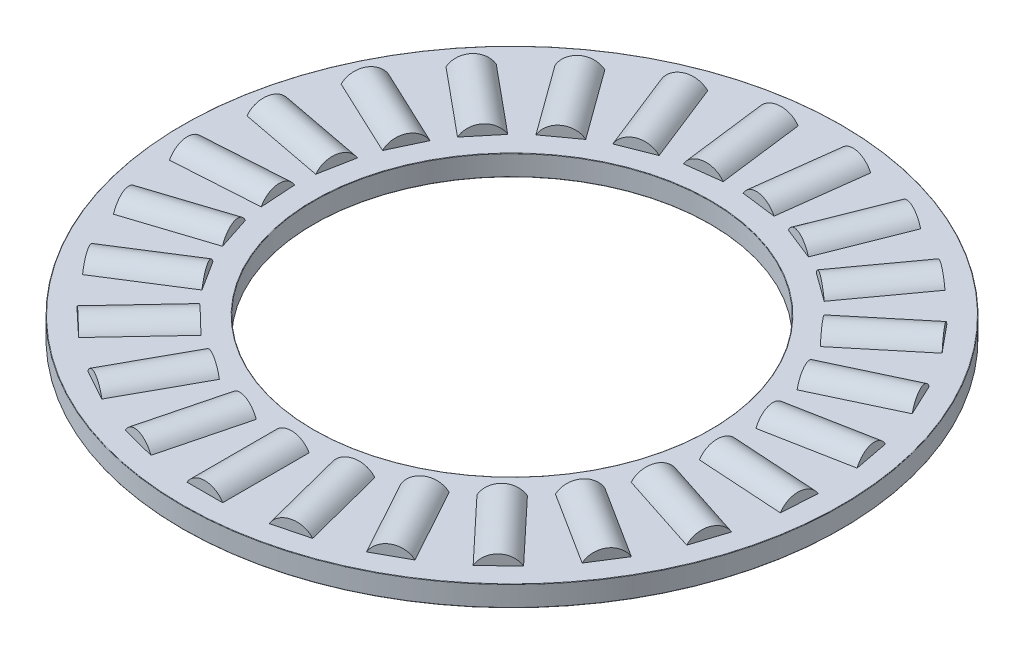
from build123d import *

# Parameters (mm, degrees)
SKETCH1_W         = 6.3246
SKETCH1_H         = 0.9921875
SKETCH3_W         = 4.1671875
SKETCH3_H         = 0.9921875
SKETCH2_W         = 4.1671875
SKETCH2_H         = 0.9921875
CIRPATTERN1_COUNT = 25
CIRPATTERN1_ANGLE = 345.6
CIRPATTERN2_COUNT = 25
FILLET2_R         = 0.01984375


with BuildPart() as part:
    # Sketch1 → Revolve1 (revolve)
    with BuildSketch(Plane(origin=(0, 0, 0), x_dir=(0, 0, -1), z_dir=(1, 0, 0)), mode=Mode.PRIVATE) as revolve1_sk:
        with Locations((-12.7127, 0)):
            Rectangle(SKETCH1_W, SKETCH1_H)
    revolve(revolve1_sk.sketch.rotate(Axis((0, -0.9921875, 0), (0, 1, 0)), 180), axis=Axis((0, -0.9921875, 0), (0, 1, 0)))

    # Sketch3 → Cut-Revolve1 (revolve, cut)
    with BuildSketch(Plane(origin=(0, 0, 0), x_dir=(0, 0, -1), z_dir=(1, 0, 0))):
        with Locations((-12.7127, 0.49609375)):
            Rectangle(SKETCH3_W, SKETCH3_H)
    cut_revolve1 = revolve(axis=Axis((0, 0, 14.79629375), (0, 0, -1)), mode=Mode.SUBTRACT)

    # CirPattern2: Cut-Revolve1 ×25 about axis
    cirpattern2_axis = Axis((0, 0, 0), (0, 1, 0))
    for i in range(1, CIRPATTERN2_COUNT):
        add(cut_revolve1.rotate(cirpattern2_axis, i * 360 / CIRPATTERN2_COUNT), mode=Mode.SUBTRACT)

    # Fillet2
    fillet2_edges = [part.edges().sort_by_distance(p)[0] for p in [
        (0, 0.49609375, 15.875),
        (0, 0.49609375, 9.5504),
        (0, -0.49609375, 9.5504),
        (0, -0.49609375, 15.875),
    ]]
    fillet(fillet2_edges, radius=FILLET2_R)


with BuildPart() as body_2:
    # Sketch2 → Revolve2 (revolve)
    with BuildSketch(Plane(origin=(0, 0, 0), x_dir=(0, 0, -1), z_dir=(1, 0, 0)), mode=Mode.PRIVATE) as revolve2_sk:
        with Locations((-12.7127, 0.49609375)):
            Rectangle(SKETCH2_W, SKETCH2_H)
    revolve(revolve2_sk.sketch.rotate(Axis((0, 0, 14.79629375), (0, 0, -1)), 90), axis=Axis((0, 0, 14.79629375), (0, 0, -1)))


with BuildPart() as cirpattern1_1:
    # CirPattern1: pattern copy
    add(body_2.part.rotate(Axis((0, 0.9921875, 0), (0, -1, 0)), 1 * CIRPATTERN1_ANGLE / (CIRPATTERN1_COUNT - 1)))


with BuildPart() as cirpattern1_2:
    # CirPattern1: pattern copy
    add(body_2.part.rotate(Axis((0, 0.9921875, 0), (0, -1, 0)), 2 * CIRPATTERN1_ANGLE / (CIRPATTERN1_COUNT - 1)))


with BuildPart() as cirpattern1_3:
    # CirPattern1: pattern copy
    add(body_2.part.rotate(Axis((0, 0.9921875, 0), (0, -1, 0)), 3 * CIRPATTERN1_ANGLE / (CIRPATTERN1_COUNT - 1)))


with BuildPart() as cirpattern1_4:
    # CirPattern1: pattern copy
    add(body_2.part.rotate(Axis((0, 0.9921875, 0), (0, -1, 0)), 4 * CIRPATTERN1_ANGLE / (CIRPATTERN1_COUNT - 1)))


with BuildPart() as cirpattern1_5:
    # CirPattern1: pattern copy
    add(body_2.part.rotate(Axis((0, 0.9921875, 0), (0, -1, 0)), 5 * CIRPATTERN1_ANGLE / (CIRPATTERN1_COUNT - 1)))


with BuildPart() as cirpattern1_6:
    # CirPattern1: pattern copy
    add(body_2.part.rotate(Axis((0, 0.9921875, 0), (0, -1, 0)), 6 * CIRPATTERN1_ANGLE / (CIRPATTERN1_COUNT - 1)))


with BuildPart() as cirpattern1_7:
    # CirPattern1: pattern copy
    add(body_2.part.rotate(Axis((0, 0.9921875, 0), (0, -1, 0)), 7 * CIRPATTERN1_ANGLE / (CIRPATTERN1_COUNT - 1)))


with BuildPart() as cirpattern1_8:
    # CirPattern1: pattern copy
    add(body_2.part.rotate(Axis((0, 0.9921875, 0), (0, -1, 0)), 8 * CIRPATTERN1_ANGLE / (CIRPATTERN1_COUNT - 1)))


with BuildPart() as cirpattern1_9:
    # CirPattern1: pattern copy
    add(body_2.part.rotate(Axis((0, 0.9921875, 0), (0, -1, 0)), 9 * CIRPATTERN1_ANGLE / (CIRPATTERN1_COUNT - 1)))


with BuildPart() as cirpattern1_10:
    # CirPattern1: pattern copy
    add(body_2.part.rotate(Axis((0, 0.9921875, 0), (0, -1, 0)), 10 * CIRPATTERN1_ANGLE / (CIRPATTERN1_COUNT - 1)))


with BuildPart() as cirpattern1_11:
    # CirPattern1: pattern copy
    add(body_2.part.rotate(Axis((0, 0.9921875, 0), (0, -1, 0)), 11 * CIRPATTERN1_ANGLE / (CIRPATTERN1_COUNT - 1)))


with BuildPart() as cirpattern1_12:
    # CirPattern1: pattern copy
    add(body_2.part.rotate(Axis((0, 0.9921875, 0), (0, -1, 0)), 12 * CIRPATTERN1_ANGLE / (CIRPATTERN1_COUNT - 1)))


with BuildPart() as cirpattern1_13:
    # CirPattern1: pattern copy
    add(body_2.part.rotate(Axis((0, 0.9921875, 0), (0, -1, 0)), 13 * CIRPATTERN1_ANGLE / (CIRPATTERN1_COUNT - 1)))


with BuildPart() as cirpattern1_14:
    # CirPattern1: pattern copy
    add(body_2.part.rotate(Axis((0, 0.9921875, 0), (0, -1, 0)), 14 * CIRPATTERN1_ANGLE / (CIRPATTERN1_COUNT - 1)))


with BuildPart() as cirpattern1_15:
    # CirPattern1: pattern copy
    add(body_2.part.rotate(Axis((0, 0.9921875, 0), (0, -1, 0)), 15 * CIRPATTERN1_ANGLE / (CIRPATTERN1_COUNT - 1)))


with BuildPart() as cirpattern1_16:
    # CirPattern1: pattern copy
    add(body_2.part.rotate(Axis((0, 0.9921875, 0), (0, -1, 0)), 16 * CIRPATTERN1_ANGLE / (CIRPATTERN1_COUNT - 1)))


with BuildPart() as cirpattern1_17:
    # CirPattern1: pattern copy
    add(body_2.part.rotate(Axis((0, 0.9921875, 0), (0, -1, 0)), 17 * CIRPATTERN1_ANGLE / (CIRPATTERN1_COUNT - 1)))


with BuildPart() as cirpattern1_18:
    # CirPattern1: pattern copy
    add(body_2.part.rotate(Axis((0, 0.9921875, 0), (0, -1, 0)), 18 * CIRPATTERN1_ANGLE / (CIRPATTERN1_COUNT - 1)))


with BuildPart() as cirpattern1_19:
    # CirPattern1: pattern copy
    add(body_2.part.rotate(Axis((0, 0.9921875, 0), (0, -1, 0)), 19 * CIRPATTERN1_ANGLE / (CIRPATTERN1_COUNT - 1)))


with BuildPart() as cirpattern1_20:
    # CirPattern1: pattern copy
    add(body_2.part.rotate(Axis((0, 0.9921875, 0), (0, -1, 0)), 20 * CIRPATTERN1_ANGLE / (CIRPATTERN1_COUNT - 1)))


with BuildPart() as cirpattern1_21:
    # CirPattern1: pattern copy
    add(body_2.part.rotate(Axis((0, 0.9921875, 0), (0, -1, 0)), 21 * CIRPATTERN1_ANGLE / (CIRPATTERN1_COUNT - 1)))


with BuildPart() as cirpattern1_22:
    # CirPattern1: pattern copy
    add(body_2.part.rotate(Axis((0, 0.9921875, 0), (0, -1, 0)), 22 * CIRPATTERN1_ANGLE / (CIRPATTERN1_COUNT - 1)))


with BuildPart() as cirpattern1_23:
    # CirPattern1: pattern copy
    add(body_2.part.rotate(Axis((0, 0.9921875, 0), (0, -1, 0)), 23 * CIRPATTERN1_ANGLE / (CIRPATTERN1_COUNT - 1)))


with BuildPart() as cirpattern1_24:
    # CirPattern1: pattern copy
    add(body_2.part.rotate(Axis((0, 0.9921875, 0), (0, -1, 0)), 24 * CIRPATTERN1_ANGLE / (CIRPATTERN1_COUNT - 1)))


solid = Compound([part.part, body_2.part, cirpattern1_1.part, cirpattern1_2.part, cirpattern1_3.part, cirpattern1_4.part, cirpattern1_5.part, cirpattern1_6.part, cirpattern1_7.part, cirpattern1_8.part, cirpattern1_9.part, cirpattern1_10.part, cirpattern1_11.part, cirpattern1_12.part, cirpattern1_13.part, cirpattern1_14.part, cirpattern1_15.part, cirpattern1_16.part, cirpattern1_17.part, cirpattern1_18.part, cirpattern1_19.part, cirpattern1_20.part, cirpattern1_21.part, cirpattern1_22.part, cirpattern1_23.part, cirpattern1_24.part])
